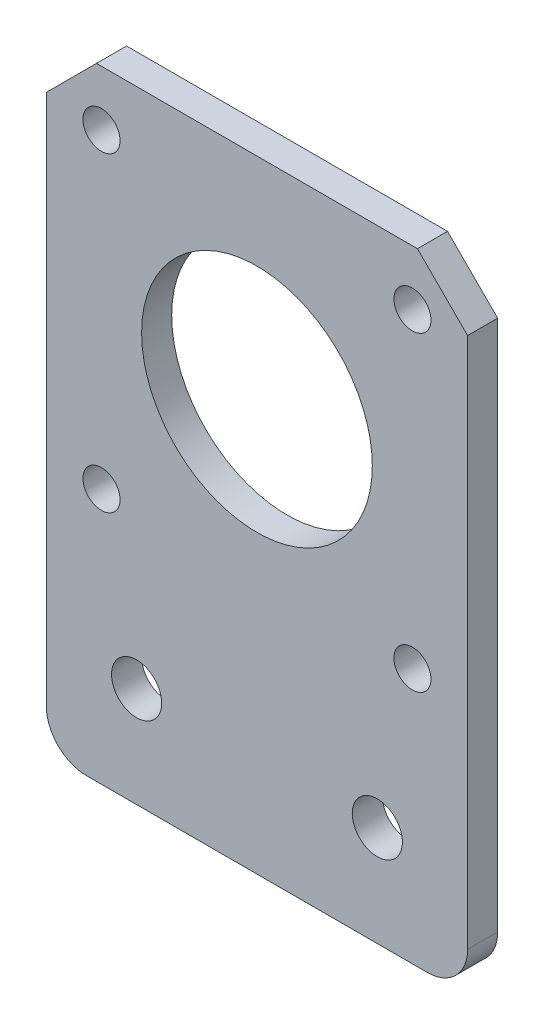
from build123d import *

# Parameters (mm, degrees)
SKETCH_1_R      = 1.849740933
SKETCH_1_R_2    = 2.5
SKETCH_1_R_3    = 11.5
EXTRUDE_1_DEPTH = 3
FILLET_1_R      = 4
CHAMFER_1_SIZE  = 5


with BuildPart() as part:
    # 草圖1 → 填料-伸長1 (new body)
    with BuildSketch(Plane.XY):
        Polygon((-21, 21), (21, 21), (21, -21), (21, -41), (-21, -41), (-21, -21), align=None)
        with Locations((-15.5, 15.5)):
            Circle(SKETCH_1_R, mode=Mode.SUBTRACT)
        with Locations(Location((15.5, 15.5, 0), (0, 0, 180))):
            Circle(SKETCH_1_R, mode=Mode.SUBTRACT)
        with Locations((15.5, -15.5)):
            Circle(SKETCH_1_R, mode=Mode.SUBTRACT)
        with Locations(Location((-15.5, -15.5, 0), (0, 0, 180))):
            Circle(SKETCH_1_R, mode=Mode.SUBTRACT)
        with Locations((-12, -31)):
            Circle(SKETCH_1_R_2, mode=Mode.SUBTRACT)
        with Locations(Location((12, -31, 0), (0, 0, 180))):
            Circle(SKETCH_1_R_2, mode=Mode.SUBTRACT)
        Circle(SKETCH_1_R_3, mode=Mode.SUBTRACT)
    extrude(amount=EXTRUDE_1_DEPTH)

    # 圓角1
    fillet_1_edges = [part.edges().sort_by_distance(p)[0] for p in [
        (21, -41, 1.5),
        (-21, -41, 1.5),
    ]]
    fillet(fillet_1_edges, radius=FILLET_1_R)

    # 導角1
    chamfer_1_edges = [part.edges().sort_by_distance(p)[0] for p in [
        (-21, 21, 1.5),
        (21, 21, 1.5),
    ]]
    chamfer(chamfer_1_edges, length=CHAMFER_1_SIZE)


solid = part.part
